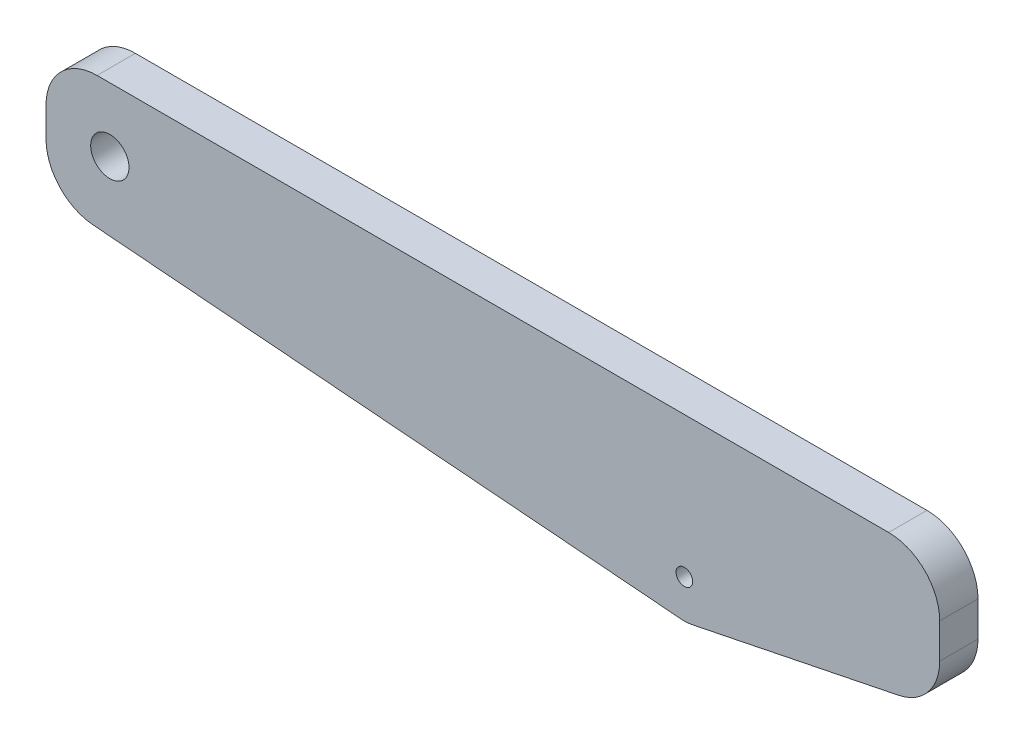
from build123d import *

# Parameters (mm, degrees)
SKETCH1_R           = 7.5
SKETCH1_R_2         = 3.25
BOSS_EXTRUDE1_DEPTH = 15
FILLET1_R           = 20
FILLET2_R           = 20
FILLET3_R           = 20
FILLET4_R           = 20


with BuildPart() as part:
    # Sketch1 → Boss-Extrude1 (new body)
    with BuildSketch(Plane.XY):
        with BuildLine():
            Line((75, 50), (105, 50))
            Line((105, 50), (350, 50))
            Line((350, 50), (350, 3.7471e-05))
            Line((350, 3.7471e-05), (252.995324667, -19.768817559))
            ThreePointArc((252.995324667, -19.768817559), (250.90496409, -20.043601976), (248.796724988, -20.022585277))
            Line((248.796724988, -20.022585277), (0, 0))
            Line((0, 0), (0, 50))
            Line((0, 50), (75, 50))
        make_face()
        with Locations((25, 25)):
            Circle(SKETCH1_R, mode=Mode.SUBTRACT)
        with Locations((250, -5.070925528)):
            Circle(SKETCH1_R_2, mode=Mode.SUBTRACT)
    extrude(amount=BOSS_EXTRUDE1_DEPTH)

    # Fillet1
    fillet1_edges = [part.edges().sort_by_distance(p)[0] for p in [
        (0, 50, 7.5),
    ]]
    fillet(fillet1_edges, radius=FILLET1_R)

    # Fillet2
    fillet2_edges = [part.edges().sort_by_distance(p)[0] for p in [
        (0, 0, 7.5),
    ]]
    fillet(fillet2_edges, radius=FILLET2_R)

    # Fillet3
    fillet3_edges = [part.edges().sort_by_distance(p)[0] for p in [
        (350, 50, 7.5),
    ]]
    fillet(fillet3_edges, radius=FILLET3_R)

    # Fillet4
    fillet4_edges = [part.edges().sort_by_distance(p)[0] for p in [
        (350, 3.7471e-05, 7.5),
    ]]
    fillet(fillet4_edges, radius=FILLET4_R)


solid = part.part
